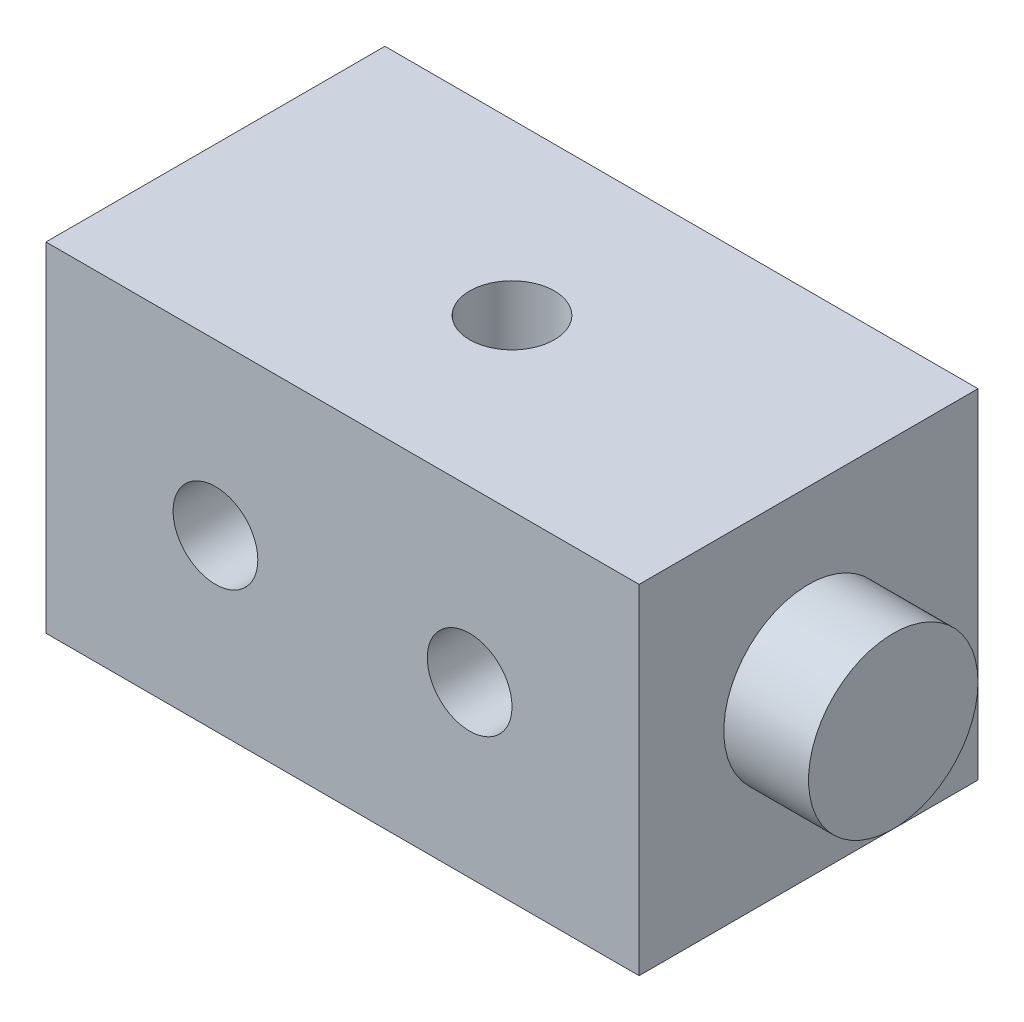
from build123d import *

# Parameters (mm, degrees)
SKETCH1_W           = 44.45
SKETCH1_H           = 25.4
SKETCH1_R           = 3.175
BOSS_EXTRUDE1_DEPTH = 25.4
SKETCH2_R           = 6.35
BOSS_EXTRUDE2_DEPTH = 6.35
SKETCH3_R           = 3.175
CUT_EXTRUDE1_DEPTH  = 63.217039467


with BuildPart() as part:
    # Sketch1 → Boss-Extrude1 (new body)
    with BuildSketch(Plane.XY):
        with Locations((22.225, 12.7)):
            Rectangle(SKETCH1_W, SKETCH1_H)
        with Locations((12.7, 12.7)):
            Circle(SKETCH1_R, mode=Mode.SUBTRACT)
        with Locations((31.75, 12.7)):
            Circle(SKETCH1_R, mode=Mode.SUBTRACT)
    extrude(amount=BOSS_EXTRUDE1_DEPTH)

    # Sketch2 → Boss-Extrude2 (add)
    with BuildSketch(Plane(origin=(44.45, 0, 0), x_dir=(0, 0, -1), z_dir=(1, 0, 0))):
        with Locations((-12.7, 12.7)):
            Circle(SKETCH2_R)
    extrude(amount=BOSS_EXTRUDE2_DEPTH)

    # Sketch3 → Cut-Extrude1 (cut, through all)
    with BuildSketch(Plane(origin=(0, 25.4, 0), x_dir=(1, 0, 0), z_dir=(0, 1, 0))):
        with Locations(Location((22.225, -12.7, 0), (0, 0, 270))):
            Circle(SKETCH3_R)
    extrude(amount=-CUT_EXTRUDE1_DEPTH, mode=Mode.SUBTRACT)


solid = part.part
